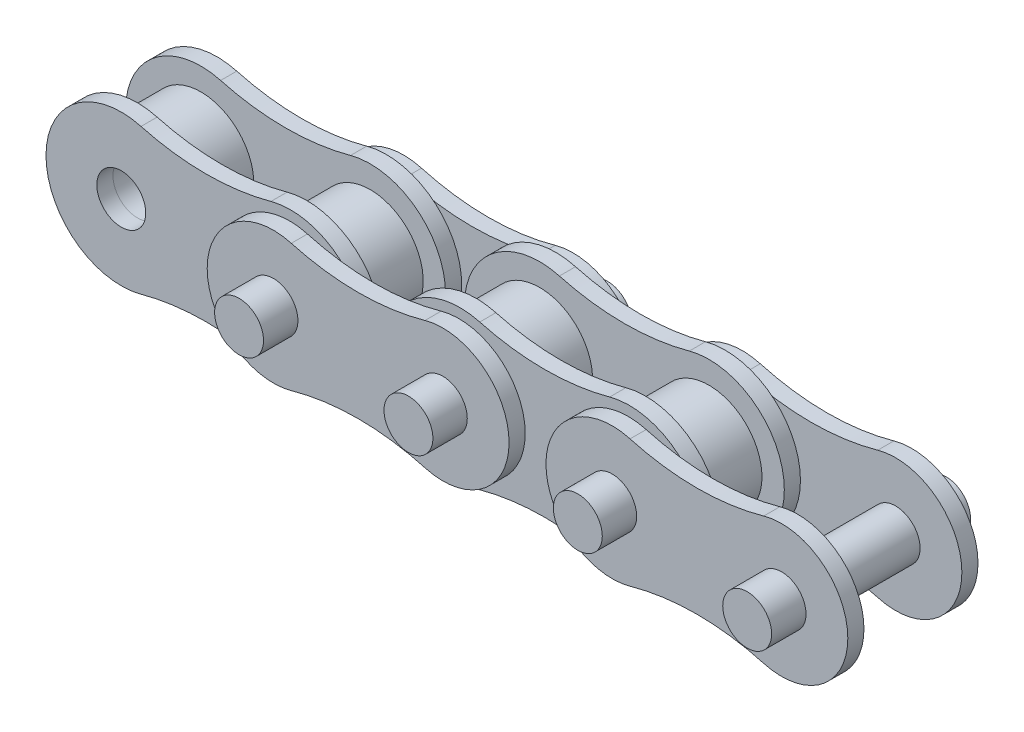
from build123d import *

# Parameters (mm, degrees)
SKETCH4_R                  = 2.5
SKETCH4_R_2                = 1.1567
BOSS_EXTRUDE1_DEPTH        = 1.5
BOSS_EXTRUDE1_2_DEPTH      = 1.5
SKETCH5_R                  = 1.1557
BOSS_EXTRUDE2_DEPTH        = 0.762
LPATTERN1_COUNT            = 2
LPATTERN1_PITCH            = 8.001
SKETCH7_R                  = 1.1557
BOSS_EXTRUDE3_DEPTH        = 0.762
BOSS_EXTRUDE4_DEPTH        = 4.699
BOSS_EXTRUDE4_DEPTH_BACK   = 4.699
SKETCH8_R                  = 1.1557
BOSS_EXTRUDE4_2_DEPTH      = 4.699
BOSS_EXTRUDE4_2_DEPTH_BACK = 4.699
LPATTERN2_COUNT            = 2
LPATTERN2_PITCH            = 16.002


with BuildPart() as part:
    # Sketch4 → Boss-Extrude1 (new, symmetric)
    with BuildSketch(Plane.XY):
        with Locations((-4.0005, 0)):
            Circle(SKETCH4_R)
        with Locations((-4.0005, 0)):
            Circle(SKETCH4_R_2, mode=Mode.SUBTRACT)
    extrude(amount=BOSS_EXTRUDE1_DEPTH, both=True)


with BuildPart() as body_2:
    # Sketch4 → Boss-Extrude1 2 (new, symmetric)
    with BuildSketch(Plane.XY):
        with Locations((4.0005, 0)):
            Circle(SKETCH4_R)
        with Locations((4.0005, 0)):
            Circle(SKETCH4_R_2, mode=Mode.SUBTRACT)
    extrude(amount=BOSS_EXTRUDE1_2_DEPTH, both=True)


with BuildPart() as body_3:
    # Sketch5 → Boss-Extrude2 (new body)
    with BuildSketch(Plane.XY.offset(1.5)):
        with BuildLine():
            ThreePointArc((-3.068796943, 3.431772926), (-7.5565, 0), (-3.068796943, -3.431772926))
            ThreePointArc((-3.068796943, -3.431772926), (0, -3.0226), (3.068796943, -3.431772926))
            ThreePointArc((3.068796943, -3.431772926), (7.5565, 0), (3.068796943, 3.431772926))
            ThreePointArc((3.068796943, 3.431772926), (0, 3.0226), (-3.068796943, 3.431772926))
        make_face()
        with Locations((-4.0005, 0)):
            Circle(SKETCH5_R, mode=Mode.SUBTRACT)
        with Locations((4.0005, 0)):
            Circle(SKETCH5_R, mode=Mode.SUBTRACT)
    extrude(amount=BOSS_EXTRUDE2_DEPTH)


with BuildPart() as lpattern1_1:
    # LPattern1: pattern copy
    add(body_2.part.moved(Location(Vector(1, 0, 0) * (1 * LPATTERN1_PITCH))))


with BuildPart() as body_5:
    # Sketch7 → Boss-Extrude3 (new body)
    with BuildSketch(Plane.XY.offset(-2.3128)):
        with BuildLine():
            ThreePointArc((4.843971698, 3.013461268), (0.87122, 0), (4.843971698, -3.013461268))
            ThreePointArc((4.843971698, -3.013461268), (8.001, -2.579963599), (11.158028302, -3.013461268))
            ThreePointArc((11.158028302, -3.013461268), (15.13078, 0), (11.158028302, 3.013461268))
            ThreePointArc((11.158028302, 3.013461268), (8.001, 2.579963599), (4.843971698, 3.013461268))
        make_face()
        with Locations((4.0005, 0)):
            Circle(SKETCH7_R, mode=Mode.SUBTRACT)
        with Locations((12.0015, 0)):
            Circle(SKETCH7_R, mode=Mode.SUBTRACT)
    extrude(amount=-BOSS_EXTRUDE3_DEPTH)


with BuildPart() as body_6:
    # Mirror1: mirrored copy
    add(body_3.part.mirror(Plane.XY))


with BuildPart() as body_7:
    # Mirror1 2: mirrored copy
    add(body_5.part.mirror(Plane.XY))


with BuildPart() as body_8:
    # Sketch8 → Boss-Extrude4 (new, two sides: drawn at the far end of the back side and taken through both)
    with BuildSketch(Plane.XY.offset(-BOSS_EXTRUDE4_DEPTH_BACK)):
        with Locations((4.0005, 0)):
            Circle(SKETCH8_R)
    extrude(amount=BOSS_EXTRUDE4_DEPTH + BOSS_EXTRUDE4_DEPTH_BACK)


with BuildPart() as body_9:
    # Sketch8 → Boss-Extrude4 2 (new, two sides: drawn at the far end of the back side and taken through both)
    with BuildSketch(Plane.XY.offset(-BOSS_EXTRUDE4_2_DEPTH_BACK)):
        with Locations((12.0015, 0)):
            Circle(SKETCH8_R)
    extrude(amount=BOSS_EXTRUDE4_2_DEPTH + BOSS_EXTRUDE4_2_DEPTH_BACK)


with BuildPart() as lpattern2_1:
    # LPattern2: pattern copy
    add(body_9.part.moved(Location(Vector(1, 0, 0) * (1 * LPATTERN2_PITCH))))


with BuildPart() as lpattern2_2:
    # LPattern2: pattern copy
    add(body_8.part.moved(Location(Vector(1, 0, 0) * (1 * LPATTERN2_PITCH))))


with BuildPart() as lpattern2_3:
    # LPattern2: pattern copy
    add(body_7.part.moved(Location(Vector(1, 0, 0) * (1 * LPATTERN2_PITCH))))


with BuildPart() as lpattern2_4:
    # LPattern2: pattern copy
    add(body_6.part.moved(Location(Vector(1, 0, 0) * (1 * LPATTERN2_PITCH))))


with BuildPart() as lpattern2_5:
    # LPattern2: pattern copy
    add(body_5.part.moved(Location(Vector(1, 0, 0) * (1 * LPATTERN2_PITCH))))


with BuildPart() as lpattern2_6:
    # LPattern2: pattern copy
    add(lpattern1_1.part.moved(Location(Vector(1, 0, 0) * (1 * LPATTERN2_PITCH))))


with BuildPart() as lpattern2_7:
    # LPattern2: pattern copy
    add(body_3.part.moved(Location(Vector(1, 0, 0) * (1 * LPATTERN2_PITCH))))


with BuildPart() as lpattern2_8:
    # LPattern2: pattern copy
    add(body_2.part.moved(Location(Vector(1, 0, 0) * (1 * LPATTERN2_PITCH))))


with BuildPart() as lpattern2_9:
    # LPattern2: pattern copy
    add(part.part.moved(Location(Vector(1, 0, 0) * (1 * LPATTERN2_PITCH))))


with BuildPart() as body_2_1:
    add(body_2.part)

    # Combine1: union body 3, LPattern1_1, body 5, body 6, body 7, body 8, body 9, LPattern2_1, LPattern2_2, LPattern2_3, LPattern2_4, LPattern2_5, LPattern2_7, LPattern2_8, LPattern2_9, part
    add(body_3.part)
    add(lpattern1_1.part)
    add(body_5.part)
    add(body_6.part)
    add(body_7.part)
    add(body_8.part)
    add(body_9.part)
    add(lpattern2_1.part)
    add(lpattern2_2.part)
    add(lpattern2_3.part)
    add(lpattern2_4.part)
    add(lpattern2_5.part)
    add(lpattern2_7.part)
    add(lpattern2_8.part)
    add(lpattern2_9.part)
    add(part.part)


solid = body_2_1.part
